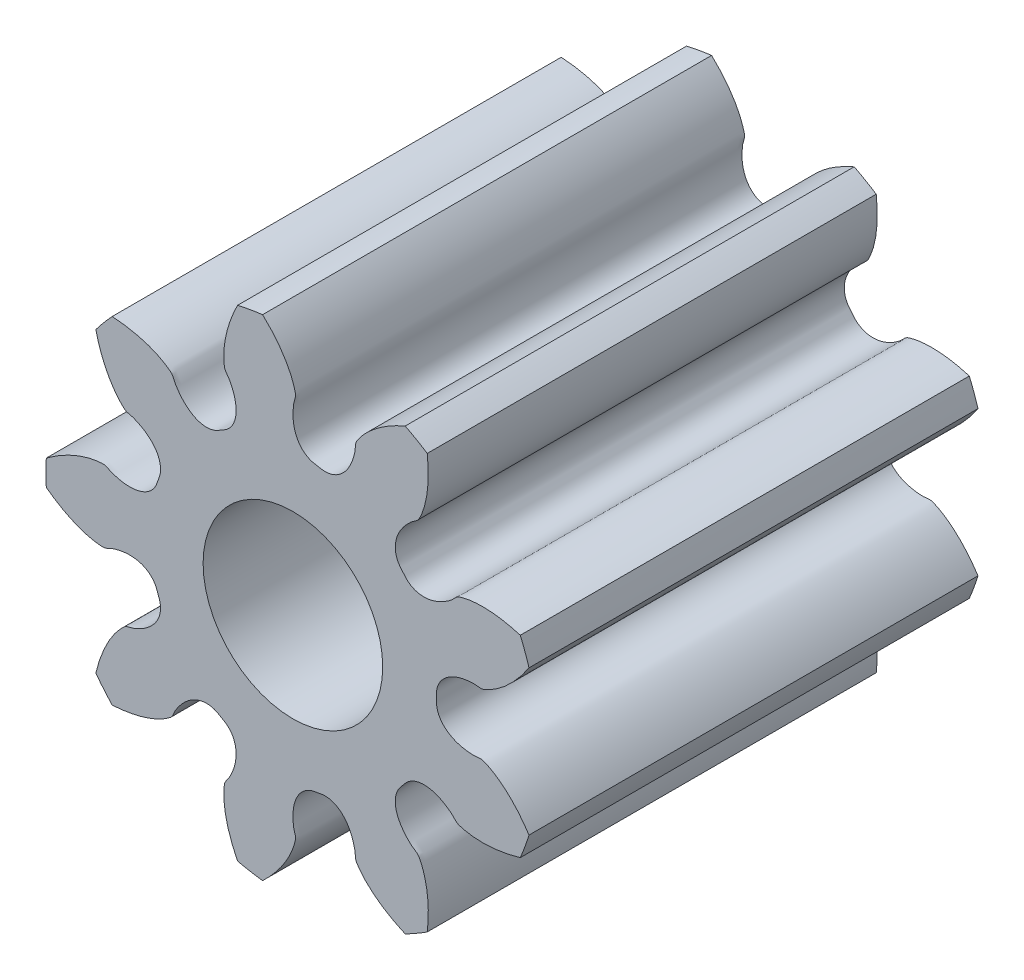
from build123d import *

# Parameters (mm, degrees)
SKETCH_175_W               = 5
SKETCH_175_H               = 2.749999959
CUT_EXTRUDE_398_DEPTH      = 2.5
PATTERN_CIRCULAR_448_COUNT = 9
SKETCH_495_W               = 5
SKETCH_495_H               = 1


with BuildPart() as part:
    # Sketch 175 → Revolve 239 (revolve)
    with BuildSketch(Plane(origin=(0, 0, 0), x_dir=(0, 0, -1), z_dir=(1, 0, 0))):
        with Locations((0, 1.37499998)):
            Rectangle(SKETCH_175_W, SKETCH_175_H)
    revolve(axis=Axis((0, 0, 0), (0, 0, -1)))

    # Sketch 284 → Cut-Extrude 398 (cut, symmetric)
    with BuildSketch(Plane.XY):
        with BuildLine():
            ThreePointArc((2.64678863, 0.833747395), (2.774999958, 0), (2.64678863, -0.833747395))
            add(Edge.make_bspline(
                [(2.64678863, -0.833747395), (2.62104343, -0.792787548), (2.581029369, -0.734463595), (2.524324438, -0.662409131), (2.483271843, -0.614571699), (2.44283446, -0.571310973), (2.403322342, -0.532483371), (2.365034267, -0.497927092), (2.328256692, -0.467463958), (2.293263068, -0.440896842), (2.260312266, -0.418021333), (2.229650042, -0.398591296), (2.201500918, -0.382432902), (2.17609062, -0.369088931), (2.146677006, -0.355805458), (2.096265876, -0.331526674), (2.040201276, -0.348462582), (1.992744545, -0.345602666), (1.968868506, -0.344148817), (1.945533773, -0.341723563), (1.922717107, -0.338589799), (1.900433481, -0.334683904), (1.878687236, -0.330024233), (1.857485108, -0.324604148), (1.836833267, -0.318419317), (1.816738682, -0.311459948), (1.79720959, -0.30371215), (1.778256469, -0.295156917), (1.759893235, -0.285769818), (1.742138807, -0.275520672), (1.725019084, -0.264373552), (1.708569368, -0.25228725), (1.692837229, -0.239216459), (1.677885714, -0.225113972), (1.663796677, -0.209934253), (1.650673726, -0.193638723), (1.638644296, -0.176202942), (1.627859139, -0.157625651), (1.618490845, -0.137938906), (1.610720012, -0.117218561), (1.604748011, -0.095590964), (1.600686707, -0.073241297), (1.599125086, -0.053293275), (1.598527686, -0.028845336), (1.599681201, 0), (1.598527686, 0.028845336), (1.599125086, 0.053293275), (1.600686707, 0.073241297), (1.604748011, 0.095590964), (1.610720012, 0.117218561), (1.618490845, 0.137938906), (1.627859139, 0.157625651), (1.638644296, 0.176202942), (1.650673726, 0.193638723), (1.663796677, 0.209934253), (1.677885714, 0.225113972), (1.692837229, 0.239216459), (1.708569368, 0.25228725), (1.725019084, 0.264373552), (1.742138807, 0.275520672), (1.759893235, 0.285769818), (1.778256469, 0.295156917), (1.79720959, 0.30371215), (1.816738682, 0.311459948), (1.836833267, 0.318419317), (1.857485108, 0.324604148), (1.878687236, 0.330024233), (1.900433481, 0.334683904), (1.922717107, 0.338589799), (1.945533773, 0.341723563), (1.968868506, 0.344148817), (1.992744545, 0.345602666), (2.040201276, 0.348462582), (2.096265876, 0.331526674), (2.146677006, 0.355805458), (2.17609062, 0.369088931), (2.201500918, 0.382432902), (2.229650042, 0.398591296), (2.260312266, 0.418021333), (2.293263068, 0.440896842), (2.328256692, 0.467463958), (2.365034267, 0.497927092), (2.403322342, 0.532483371), (2.44283446, 0.571310973), (2.483271843, 0.614571699), (2.524324438, 0.662409131), (2.581029369, 0.734463595), (2.62104343, 0.792787548), (2.64678863, 0.833747395)],
                knots=[0, 0, 0, 0, 0.050086456, 0.073152587, 0.094900653, 0.115330655, 0.134442592, 0.152236465, 0.168712273, 0.183870017, 0.197709696, 0.21023131, 0.22143486, 0.231320346, 0.239887767, 0.255009772, 0.287655643, 0.29606578, 0.304314058, 0.312406701, 0.320350599, 0.328153379, 0.335823491, 0.343370292, 0.350804143, 0.358136499, 0.36538, 0.372548546, 0.379657354, 0.386722972, 0.393763236, 0.400797137, 0.407844559, 0.414925858, 0.422061227, 0.429269823, 0.436568633, 0.443971123, 0.451485772, 0.459114656, 0.466852386, 0.474685684, 0.482593878, 0.4875407, 0.5, 0.5124593, 0.517406122, 0.525314316, 0.533147614, 0.540885344, 0.548514228, 0.556028877, 0.563431367, 0.570730177, 0.577938773, 0.585074142, 0.592155441, 0.599202863, 0.606236764, 0.613277028, 0.620342646, 0.627451454, 0.63462, 0.641863501, 0.649195857, 0.656629708, 0.664176509, 0.671846621, 0.679649401, 0.687593299, 0.695685942, 0.70393422, 0.712344357, 0.744990228, 0.760112233, 0.768679654, 0.77856514, 0.78976869, 0.802290304, 0.816129983, 0.831287727, 0.847763535, 0.865557408, 0.884669345, 0.905099347, 0.926847413, 0.949913544, 1, 1, 1, 1], degree=3))
        make_face()
    cut_extrude_398 = extrude(amount=CUT_EXTRUDE_398_DEPTH, both=True, mode=Mode.SUBTRACT)

    # Pattern Circular 448: Cut-Extrude 398 ×9 about axis
    pattern_circular_448_axis = Axis((0, 0, 55), (0, 0, -1))
    for i in range(1, PATTERN_CIRCULAR_448_COUNT):
        add(cut_extrude_398.rotate(pattern_circular_448_axis, i * 360 / PATTERN_CIRCULAR_448_COUNT), mode=Mode.SUBTRACT)

    # Sketch 495 → Cut-Revolve 557 (revolve, cut)
    with BuildSketch(Plane(origin=(0, 0, 0), x_dir=(0, 0, -1), z_dir=(1, 0, 0))):
        with Locations((0, 0.5)):
            Rectangle(SKETCH_495_W, SKETCH_495_H)
    revolve(axis=Axis((0, 0, 0), (0, 0, -1)), mode=Mode.SUBTRACT)


solid = part.part
